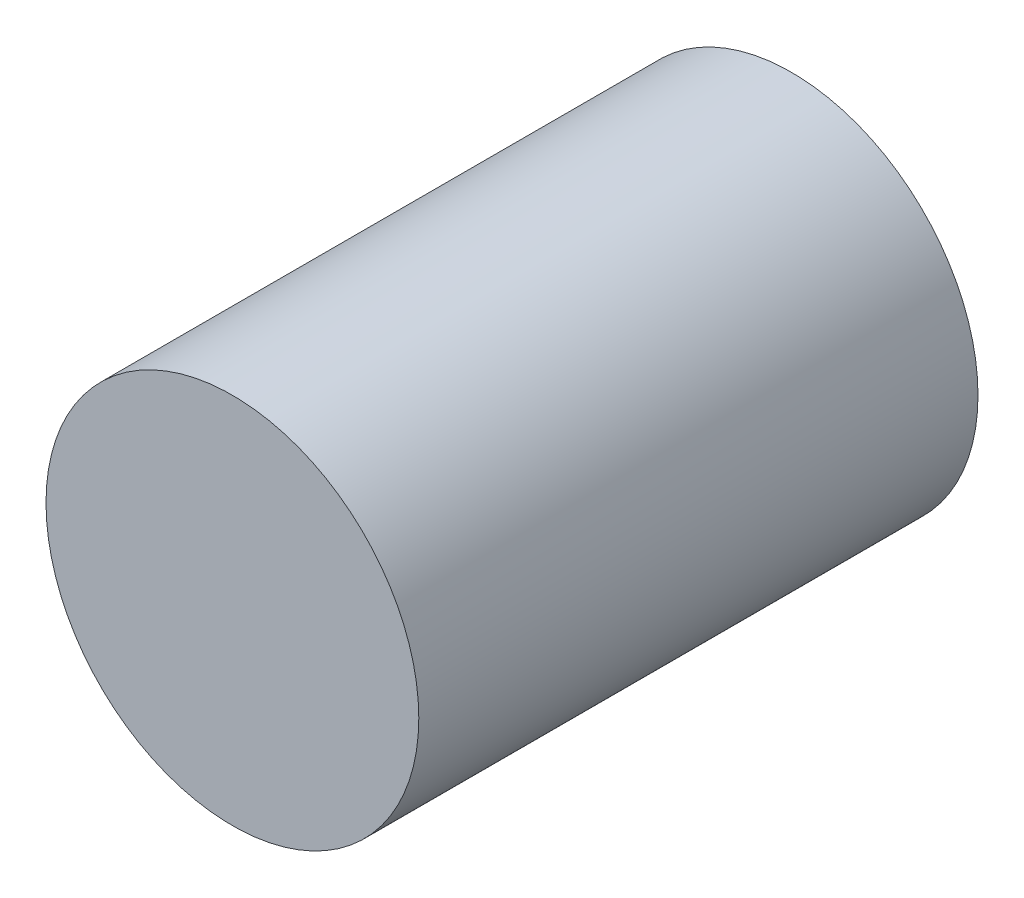
from build123d import *

# Parameters (mm, degrees)
SKETCH_1_R      = 8
EXTRUDE_1_DEPTH = 24


with BuildPart() as part:
    # 草图1 → 凸台-拉伸1 (new body)
    with BuildSketch(Plane.XY):
        Circle(SKETCH_1_R)
    extrude(amount=EXTRUDE_1_DEPTH)


solid = part.part
